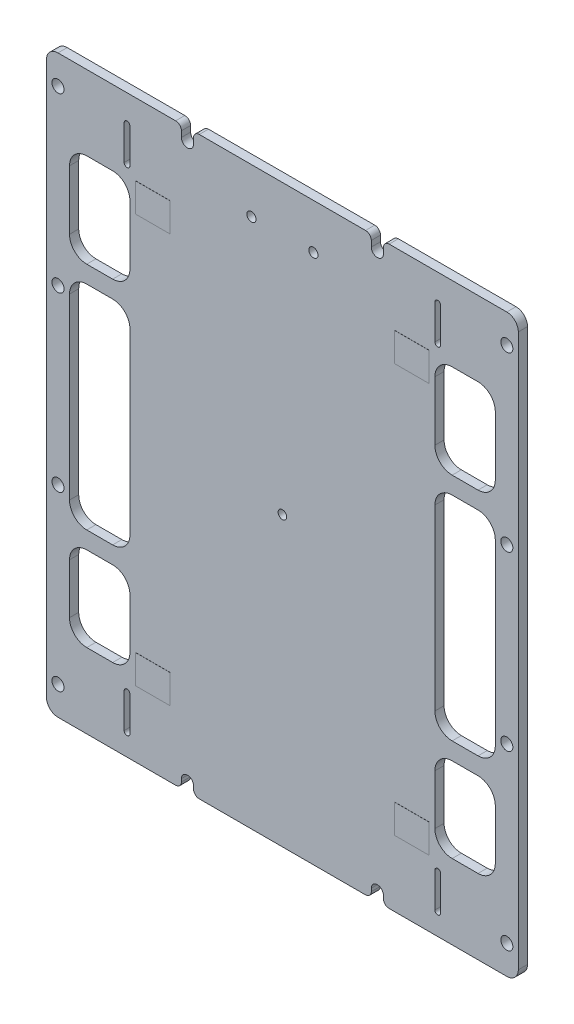
from build123d import *

# Parameters (mm, degrees)
BOARDOUTLINE_DEPTH          = 1.6
SKETCH2_R                   = 0.75
SKETCH2_R_2                 = 0.8
COMPONENTHOLES_DEPTH        = 65.680445267
SOLARCELLCONTACTHOLES_DEPTH = 1.6
WINDOWS_1SIDE_DEPTH         = 65.680445267
SKETCH5_W                   = 6
SKETCH5_H                   = 5
CONTACTPADS_DEPTH           = 0.02
M2_CLEARANCE_HOLE1_D        = 2.1
CUT_EXTRUDE1_DEPTH          = 65.680943098
FILLET3_R                   = 1
FILLET3_OF_MIRROR1_R        = 1


with BuildPart() as part:
    # Sketch1 → boardOutline (new body)
    with BuildSketch(Plane.XY):
        with BuildLine():
            Line((-39, -50), (39, -50))
            ThreePointArc((39, -50), (40.414213562, -49.414213562), (41, -48))
            Line((41, -48), (41, 48))
            ThreePointArc((41, 48), (40.414213562, 49.414213562), (39, 50))
            Line((39, 50), (-39, 50))
            ThreePointArc((-39, 50), (-40.414213562, 49.414213562), (-41, 48))
            Line((-41, 48), (-41, -48))
            ThreePointArc((-41, -48), (-40.414213562, -49.414213562), (-39, -50))
        make_face()
    extrude(amount=BOARDOUTLINE_DEPTH)

    # Sketch2 → componentHoles (cut, through all)
    with BuildSketch(Plane.XY.offset(1.6)):
        Circle(SKETCH2_R)
        with Locations((-5.38, 42.15)):
            Circle(SKETCH2_R_2)
        with Locations((5.39, 42.15)):
            Circle(SKETCH2_R_2)
    extrude(amount=-COMPONENTHOLES_DEPTH, mode=Mode.SUBTRACT)

    # Sketch4 → solarCellContactHoles (cut)
    with BuildSketch(Plane.XY.offset(1.6)):
        with BuildLine():
            Line((-27.5, 39.25), (-27.5, 45.25))
            ThreePointArc((-27.5, 45.25), (-27, 45.75), (-26.5, 45.25))
            Line((-26.5, 45.25), (-26.5, 39.25))
            ThreePointArc((-26.5, 39.25), (-27, 38.75), (-27.5, 39.25))
        make_face()
        with BuildLine():
            Line((26.5, 39.25), (26.5, 45.25))
            ThreePointArc((26.5, 45.25), (27, 45.75), (27.5, 45.25))
            Line((27.5, 45.25), (27.5, 39.25))
            ThreePointArc((27.5, 39.25), (27, 38.75), (26.5, 39.25))
        make_face()
        with BuildLine():
            Line((26.5, -46.25), (26.5, -40.25))
            ThreePointArc((26.5, -40.25), (27, -39.75), (27.5, -40.25))
            Line((27.5, -40.25), (27.5, -46.25))
            ThreePointArc((27.5, -46.25), (27, -46.75), (26.5, -46.25))
        make_face()
        with BuildLine():
            Line((-27.5, -46.25), (-27.5, -40.25))
            ThreePointArc((-27.5, -40.25), (-27, -39.75), (-26.5, -40.25))
            Line((-26.5, -40.25), (-26.5, -46.25))
            ThreePointArc((-26.5, -46.25), (-27, -46.75), (-27.5, -46.25))
        make_face()
    extrude(amount=-SOLARCELLCONTACTHOLES_DEPTH, mode=Mode.SUBTRACT)

    # Sketch3 → windows_1side (cut, through all)
    with BuildSketch(Plane.XY.offset(1.6)):
        with BuildLine():
            Line((-34, 37), (-29.5, 37))
            ThreePointArc((-29.5, 37), (-27.378679656, 36.121320344), (-26.5, 34))
            Line((-26.5, 34), (-26.5, 23.7))
            ThreePointArc((-26.5, 23.7), (-27.378679656, 21.578679656), (-29.5, 20.7))
            Line((-29.5, 20.7), (-34, 20.7))
            ThreePointArc((-34, 20.7), (-36.121320344, 21.578679656), (-37, 23.7))
            Line((-37, 23.7), (-37, 34))
            ThreePointArc((-37, 34), (-36.121320344, 36.121320344), (-34, 37))
        make_face()
        with BuildLine():
            Line((-29.5, -22.3), (-34, -22.3))
            ThreePointArc((-34, -22.3), (-36.121320344, -23.178679656), (-37, -25.3))
            Line((-37, -25.3), (-37, -34))
            ThreePointArc((-37, -34), (-36.121320344, -36.121320344), (-34, -37))
            Line((-34, -37), (-29.5, -37))
            ThreePointArc((-29.5, -37), (-27.378679656, -36.121320344), (-26.5, -34))
            Line((-26.5, -34), (-26.5, -25.3))
            ThreePointArc((-26.5, -25.3), (-27.378679656, -23.178679656), (-29.5, -22.3))
        make_face()
        with BuildLine():
            Line((-29.5, -19.3), (-34, -19.3))
            ThreePointArc((-34, -19.3), (-36.121320344, -18.421320344), (-37, -16.3))
            Line((-37, -16.3), (-37, 14.7))
            ThreePointArc((-37, 14.7), (-36.121320344, 16.821320344), (-34, 17.7))
            Line((-34, 17.7), (-29.5, 17.7))
            ThreePointArc((-29.5, 17.7), (-27.378679656, 16.821320344), (-26.5, 14.7))
            Line((-26.5, 14.7), (-26.5, -16.3))
            ThreePointArc((-26.5, -16.3), (-27.378679656, -18.421320344), (-29.5, -19.3))
        make_face()
    windows_1side = extrude(amount=-WINDOWS_1SIDE_DEPTH, mode=Mode.SUBTRACT)

    # Sketch5 → contactPads (add)
    with BuildSketch(Plane.XY.offset(1.6)):
        with Locations((-22.5, 35)):
            Rectangle(SKETCH5_W, SKETCH5_H)
        with Locations((22.5, 35)):
            Rectangle(SKETCH5_W, SKETCH5_H)
        with Locations((22.5, -36)):
            Rectangle(SKETCH5_W, SKETCH5_H)
        with Locations((-22.5, -36)):
            Rectangle(SKETCH5_W, SKETCH5_H)
    extrude(amount=CONTACTPADS_DEPTH)

    # M2 Clearance Hole1 (through all)
    with Locations(Plane(origin=(0, 0, 0), x_dir=(-1, 0, 0), z_dir=(0, 0, -1))):
        with Locations((39, 45), (39, -15), (39, -45), (39, 15)):
            m2_clearance_hole1 = Hole(M2_CLEARANCE_HOLE1_D / 2)

    # Sketch10 → Cut-Extrude1 (cut, symmetric)
    with BuildSketch(Plane(origin=(0, 0, 0), x_dir=(-1, 0, 0), z_dir=(0, 0, -1))):
        with BuildLine():
            Line((15.45, 48), (15.45, 55.073166109))
            ThreePointArc((15.45, 55.073166109), (16.5, 56.123166109), (17.55, 55.073166109))
            Line((17.55, 55.073166109), (17.55, 48))
            ThreePointArc((17.55, 48), (16.5, 46.95), (15.45, 48))
        make_face()
        with BuildLine():
            Line((17.55, -48.5), (17.55, -55.573166109))
            ThreePointArc((17.55, -55.573166109), (16.5, -56.623166109), (15.45, -55.573166109))
            Line((15.45, -55.573166109), (15.45, -48.5))
            ThreePointArc((15.45, -48.5), (16.5, -47.45), (17.55, -48.5))
        make_face()
    cut_extrude1 = extrude(amount=CUT_EXTRUDE1_DEPTH, both=True, mode=Mode.SUBTRACT)

    # Fillet3
    fillet3_edges = [part.edges().sort_by_distance(p)[0] for p in [
        (-15.45, 50, 0.8),
        (-17.55, 50, 0.8),
        (-17.55, -50, 0.8),
        (-15.45, -50, 0.8),
    ]]
    fillet(fillet3_edges, radius=FILLET3_R)

    # Mirror1: windows_1side, M2 Clearance Hole1, Cut-Extrude1 across plane
    add(windows_1side.mirror(Plane(origin=(0, 0, 0), x_dir=(0, 0, 1), z_dir=(1, 0, 0))), mode=Mode.SUBTRACT)
    add(m2_clearance_hole1.mirror(Plane(origin=(0, 0, 0), x_dir=(0, 0, 1), z_dir=(1, 0, 0))), mode=Mode.SUBTRACT)
    add(cut_extrude1.mirror(Plane(origin=(0, 0, 0), x_dir=(0, 0, 1), z_dir=(1, 0, 0))), mode=Mode.SUBTRACT)

    # Fillet3 of Mirror1
    fillet3_of_mirror1_edges = [part.edges().sort_by_distance(p)[0] for p in [
        (15.45, 50, 0.8),
        (17.55, 50, 0.8),
        (17.55, -50, 0.8),
        (15.45, -50, 0.8),
    ]]
    fillet(fillet3_of_mirror1_edges, radius=FILLET3_OF_MIRROR1_R)


solid = part.part
